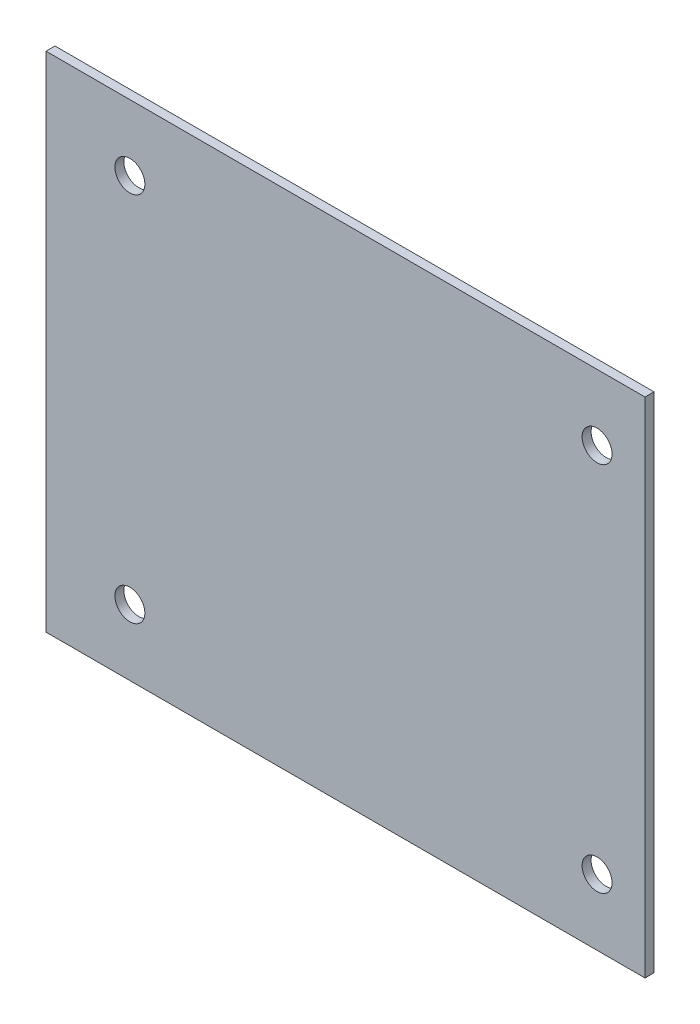
from build123d import *

# Parameters (mm, degrees)
SKETCH1_W           = 100
SKETCH1_H           = 84
SKETCH1_R           = 2.5
BOSS_EXTRUDE1_DEPTH = 1.5


with BuildPart() as part:
    # Sketch1 → Boss-Extrude1 (new body)
    with BuildSketch(Plane.XY):
        Rectangle(SKETCH1_W, SKETCH1_H)
        with Locations((-36, 31)):
            Circle(SKETCH1_R, mode=Mode.SUBTRACT)
        with Locations((42, 31)):
            Circle(SKETCH1_R, mode=Mode.SUBTRACT)
        with Locations((42, -31)):
            Circle(SKETCH1_R, mode=Mode.SUBTRACT)
        with Locations((-36, -31)):
            Circle(SKETCH1_R, mode=Mode.SUBTRACT)
    extrude(amount=BOSS_EXTRUDE1_DEPTH)


solid = part.part
